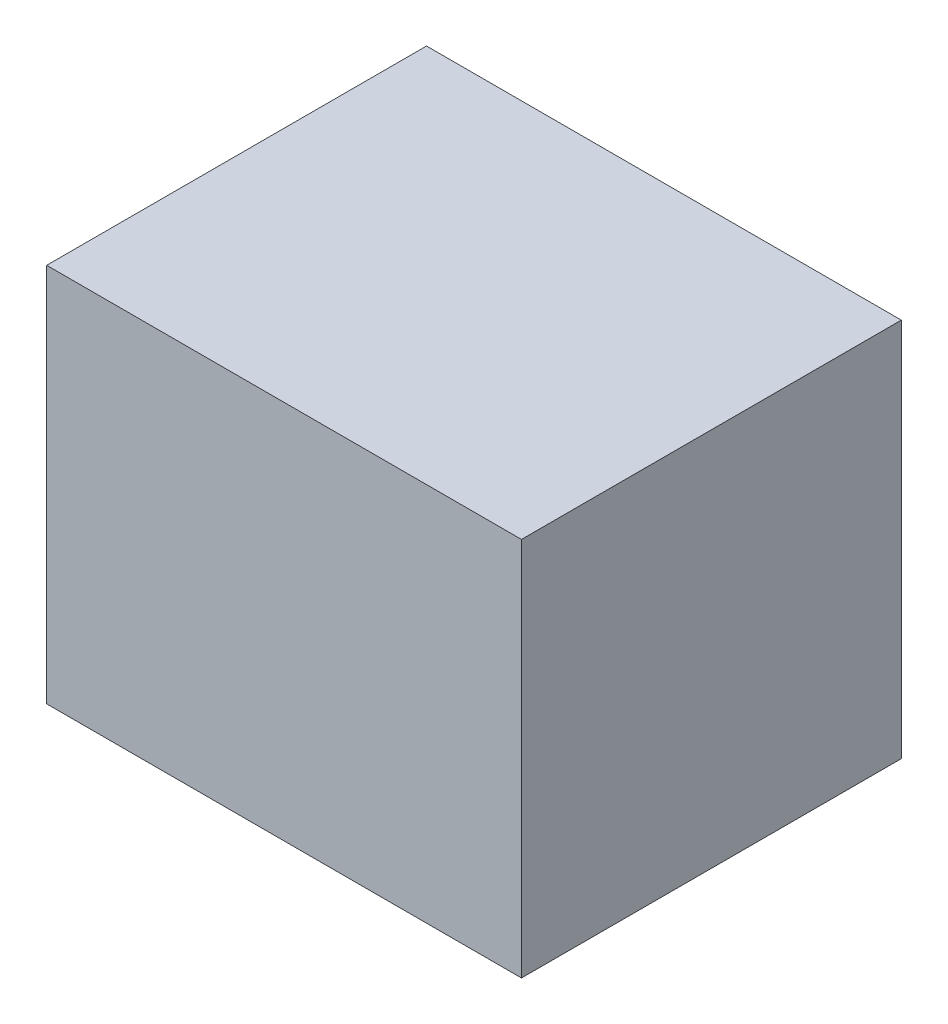
from build123d import *

# Parameters (mm, degrees)
SKETCH1_W           = 101.6
SKETCH1_H           = 101.6
BOSS_EXTRUDE1_DEPTH = 127


with BuildPart() as part:
    # Sketch1 → Boss-Extrude1 (new body)
    with BuildSketch(Plane(origin=(0, 0, 0), x_dir=(0, 0, -1), z_dir=(1, 0, 0))):
        Rectangle(SKETCH1_W, SKETCH1_H)
    extrude(amount=BOSS_EXTRUDE1_DEPTH)


solid = part.part
